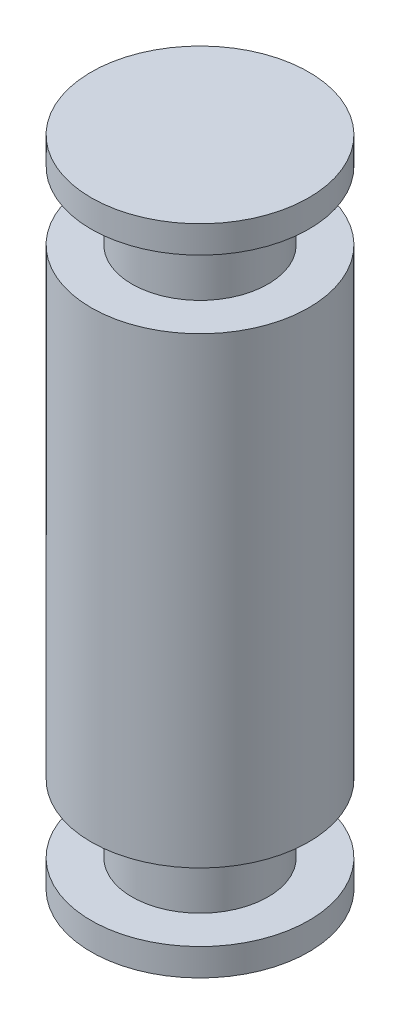
from build123d import *

# Parameters (mm, degrees)
SKETCH1_R           = 4
BOSS_EXTRUDE1_DEPTH = 17
SKETCH2_R           = 2.5
BOSS_EXTRUDE2_DEPTH = 2.5
BOSS_EXTRUDE3_START = 1
SKETCH3_R           = 4
BOSS_EXTRUDE3_DEPTH = 1
BOSS_EXTRUDE4_START = 2.5
SKETCH4_R           = 2.5
BOSS_EXTRUDE4_DEPTH = 2.5
SKETCH5_R           = 4
BOSS_EXTRUDE5_DEPTH = 1


with BuildPart() as part:
    # Sketch1 → Boss-Extrude1 (new body)
    with BuildSketch(Plane(origin=(0, 0, 0), x_dir=(1, 0, 0), z_dir=(0, 1, 0))):
        with Locations(Location((0, 0, 0), (0, 0, 270))):
            Circle(SKETCH1_R)
    extrude(amount=BOSS_EXTRUDE1_DEPTH)

    # Sketch2 → Boss-Extrude2 (add)
    with BuildSketch(Plane.XZ):
        with Locations(Location((0, 0, 0), (0, 0, 270))):
            Circle(SKETCH2_R)
    extrude(amount=BOSS_EXTRUDE2_DEPTH)

    # Sketch3 → Boss-Extrude3 (add)
    with BuildSketch(Plane.XZ.offset(2.5).offset(BOSS_EXTRUDE3_START)):
        with Locations(Location((0, 0, 0), (0, 0, 90))):
            Circle(SKETCH3_R)
    extrude(amount=-BOSS_EXTRUDE3_DEPTH)

    # Sketch4 → Boss-Extrude4 (add)
    with BuildSketch(Plane(origin=(0, 17, 0), x_dir=(1, 0, 0), z_dir=(0, 1, 0)).offset(BOSS_EXTRUDE4_START)):
        with Locations(Location((0, 0, 0), (0, 0, 90))):
            Circle(SKETCH4_R)
    extrude(amount=-BOSS_EXTRUDE4_DEPTH)

    # Sketch5 → Boss-Extrude5 (add)
    with BuildSketch(Plane(origin=(0, 19.5, 0), x_dir=(1, 0, 0), z_dir=(0, 1, 0))):
        with Locations(Location((0, 0, 0), (0, 0, 270))):
            Circle(SKETCH5_R)
    extrude(amount=BOSS_EXTRUDE5_DEPTH)


solid = part.part
